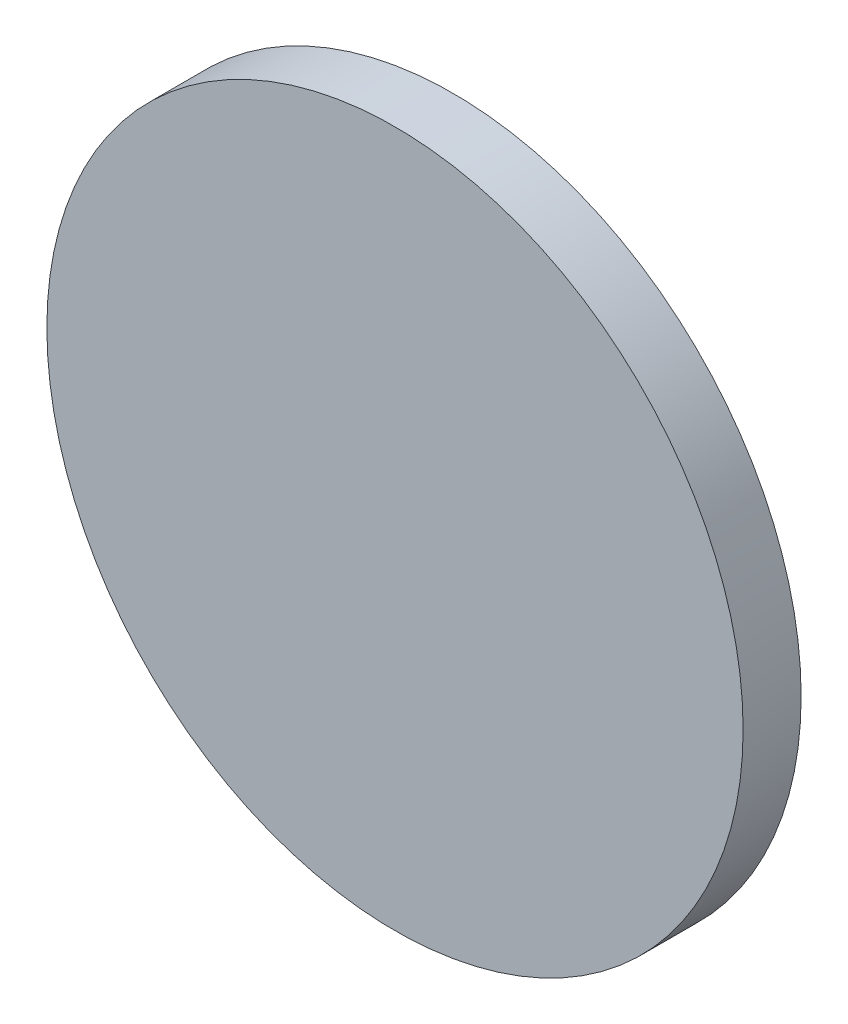
from build123d import *

# Parameters (mm, degrees)
SKETCH2_R           = 76.2
BOSS_EXTRUDE1_DEPTH = 12.7


with BuildPart() as part:
    # Sketch2 → Boss-Extrude1 (new body)
    with BuildSketch(Plane.XY):
        Circle(SKETCH2_R)
    extrude(amount=BOSS_EXTRUDE1_DEPTH)


solid = part.part
